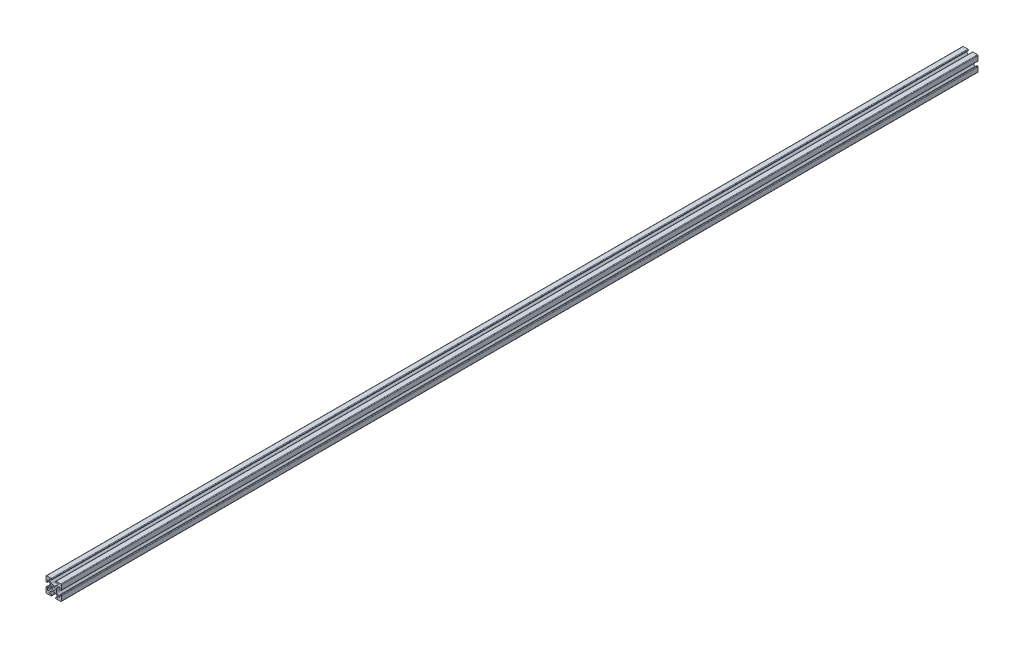
from build123d import *

# Parameters (mm, degrees)
BOSS_EXTRUDE1_DEPTH = 1524
FILLET1_R           = 2.54
FILLET2_R           = 1.016
FILLET3_R           = 1.016


with BuildPart() as part:
    # Sketch1 → Boss-Extrude1 (new body)
    with BuildSketch(Plane.XY):
        Polygon((1.562564565, 25.4), (3.912064565, 23.0505), (9.4615, 23.0505), (9.4615, 25.4), align=None)
        with BuildLine():
            Line((11.814337736, 15.148226829), (9.754064565, 17.2085))
            Line((9.754064565, 17.2085), (3.912064565, 23.0505))
            Line((3.912064565, 23.0505), (1.562564565, 25.4))
            Line((1.562564565, 25.4), (0, 25.4))
            Line((0, 25.4), (0, 23.837435435))
            Line((0, 23.837435435), (2.3495, 21.487935435))
            Line((2.3495, 21.487935435), (8.1915, 15.645935435))
            Line((8.1915, 15.645935435), (10.251773171, 13.585662264))
            ThreePointArc((10.251773171, 13.585662264), (10.859047495, 14.540952505), (11.814337736, 15.148226829))
        make_face()
        Polygon((2.3495, 15.9385), (2.3495, 21.487935435), (0, 23.837435435), (0, 15.9385), align=None)
        with BuildLine():
            Line((13.585662264, 15.148226829), (15.645935435, 17.2085))
            Line((15.645935435, 17.2085), (9.754064565, 17.2085))
            Line((9.754064565, 17.2085), (11.814337736, 15.148226829))
            ThreePointArc((11.814337736, 15.148226829), (12.7, 15.3035), (13.585662264, 15.148226829))
        make_face()
        with BuildLine():
            ThreePointArc((10.251773171, 11.814337736), (10.0965, 12.7), (10.251773171, 13.585662264))
            Line((10.251773171, 13.585662264), (8.1915, 15.645935435))
            Line((8.1915, 15.645935435), (8.1915, 9.754064565))
            Line((8.1915, 9.754064565), (10.251773171, 11.814337736))
        make_face()
        with BuildLine():
            ThreePointArc((11.814337736, 10.251773171), (10.859047495, 10.859047495), (10.251773171, 11.814337736))
            Line((10.251773171, 11.814337736), (8.1915, 9.754064565))
            Line((8.1915, 9.754064565), (2.3495, 3.912064565))
            Line((2.3495, 3.912064565), (0, 1.562564565))
            Line((0, 1.562564565), (0, 0))
            Line((0, 0), (1.562564565, 0))
            Line((1.562564565, 0), (3.912064565, 2.3495))
            Line((3.912064565, 2.3495), (9.754064565, 8.1915))
            Line((9.754064565, 8.1915), (11.814337736, 10.251773171))
        make_face()
        with BuildLine():
            ThreePointArc((13.585662264, 10.251773171), (12.7, 10.0965), (11.814337736, 10.251773171))
            Line((11.814337736, 10.251773171), (9.754064565, 8.1915))
            Line((9.754064565, 8.1915), (15.645935435, 8.1915))
            Line((15.645935435, 8.1915), (13.585662264, 10.251773171))
        make_face()
        with BuildLine():
            Line((17.2085, 9.754064565), (15.148226829, 11.814337736))
            ThreePointArc((15.148226829, 11.814337736), (14.540952505, 10.859047495), (13.585662264, 10.251773171))
            Line((13.585662264, 10.251773171), (15.645935435, 8.1915))
            Line((15.645935435, 8.1915), (21.487935435, 2.3495))
            Line((21.487935435, 2.3495), (23.837435435, 0))
            Line((23.837435435, 0), (25.4, 0))
            Line((25.4, 0), (25.4, 1.562564565))
            Line((25.4, 1.562564565), (23.0505, 3.912064565))
            Line((23.0505, 3.912064565), (17.2085, 9.754064565))
        make_face()
        with BuildLine():
            Line((17.2085, 15.645935435), (15.148226829, 13.585662264))
            ThreePointArc((15.148226829, 13.585662264), (15.264387919, 13.149585199), (15.3035, 12.7))
            ThreePointArc((15.3035, 12.7), (15.264387919, 12.250414801), (15.148226829, 11.814337736))
            Line((15.148226829, 11.814337736), (17.2085, 9.754064565))
            Line((17.2085, 9.754064565), (17.2085, 15.645935435))
        make_face()
        with BuildLine():
            Line((23.837435435, 25.4), (21.487935435, 23.0505))
            Line((21.487935435, 23.0505), (15.645935435, 17.2085))
            Line((15.645935435, 17.2085), (13.585662264, 15.148226829))
            ThreePointArc((13.585662264, 15.148226829), (14.540952505, 14.540952505), (15.148226829, 13.585662264))
            Line((15.148226829, 13.585662264), (17.2085, 15.645935435))
            Line((17.2085, 15.645935435), (23.0505, 21.487935435))
            Line((23.0505, 21.487935435), (25.4, 23.837435435))
            Line((25.4, 23.837435435), (25.4, 25.4))
            Line((25.4, 25.4), (23.837435435, 25.4))
        make_face()
        Polygon((15.9385, 23.0505), (21.487935435, 23.0505), (23.837435435, 25.4), (15.9385, 25.4), align=None)
        Polygon((25.4, 15.9385), (25.4, 23.837435435), (23.0505, 21.487935435), (23.0505, 15.9385), align=None)
        Polygon((23.0505, 9.4615), (23.0505, 3.912064565), (25.4, 1.562564565), (25.4, 9.4615), align=None)
        Polygon((23.837435435, 0), (21.487935435, 2.3495), (15.9385, 2.3495), (15.9385, 0), align=None)
        Polygon((9.4615, 2.3495), (3.912064565, 2.3495), (1.562564565, 0), (9.4615, 0), align=None)
        Polygon((0, 1.562564565), (2.3495, 3.912064565), (2.3495, 9.4615), (0, 9.4615), align=None)
    extrude(amount=BOSS_EXTRUDE1_DEPTH)

    # Fillet1
    fillet1_edges = [part.edges().sort_by_distance(p)[0] for p in [
        (15.645935435, 8.1915, 762),
        (9.754064565, 8.1915, 762),
        (8.1915, 9.754064565, 762),
        (8.1915, 15.645935435, 762),
        (9.754064565, 17.2085, 762),
        (15.645935435, 17.2085, 762),
        (17.2085, 15.645935435, 762),
        (17.2085, 9.754064565, 762),
    ]]
    fillet(fillet1_edges, radius=FILLET1_R)

    # Fillet2
    fillet2_edges = [part.edges().sort_by_distance(p)[0] for p in [
        (23.0505, 9.4615, 762),
        (25.4, 9.4615, 762),
        (25.4, 0, 762),
        (15.9385, 0, 762),
        (15.9385, 2.3495, 762),
        (9.4615, 2.3495, 762),
        (9.4615, 0, 762),
        (0, 0, 762),
        (0, 9.4615, 762),
        (2.3495, 9.4615, 762),
        (2.3495, 15.9385, 762),
        (0, 15.9385, 762),
        (0, 25.4, 762),
        (9.4615, 25.4, 762),
        (9.4615, 23.0505, 762),
        (15.9385, 23.0505, 762),
        (15.9385, 25.4, 762),
        (25.4, 25.4, 762),
        (25.4, 15.9385, 762),
        (23.0505, 15.9385, 762),
    ]]
    fillet(fillet2_edges, radius=FILLET2_R)

    # Fillet3
    fillet3_edges = [part.edges().sort_by_distance(p)[0] for p in [
        (23.0505, 3.912064565, 762),
        (21.487935435, 2.3495, 762),
        (3.912064565, 2.3495, 762),
        (2.3495, 3.912064565, 762),
        (2.3495, 21.487935435, 762),
        (3.912064565, 23.0505, 762),
        (21.487935435, 23.0505, 762),
        (23.0505, 21.487935435, 762),
    ]]
    fillet(fillet3_edges, radius=FILLET3_R)


solid = part.part
